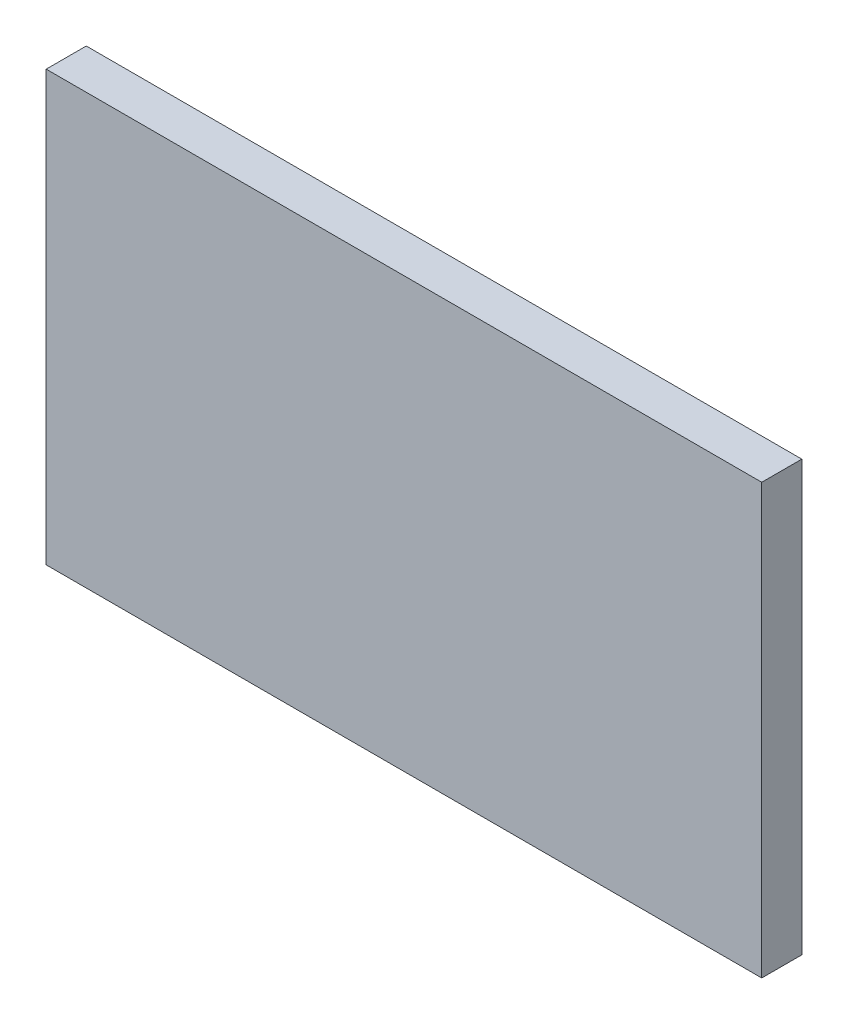
from build123d import *

# Parameters (mm, degrees)
CROQUIS1_W              = 25
CROQUIS1_H              = 15
SALIENTE_EXTRUIR1_DEPTH = 1.4


with BuildPart() as part:
    # Croquis1 → Saliente-Extruir1 (new body)
    with BuildSketch(Plane.XY):
        with Locations((-66.695768458, 17.882653061)):
            Rectangle(CROQUIS1_W, CROQUIS1_H)
    extrude(amount=SALIENTE_EXTRUIR1_DEPTH)


solid = part.part
